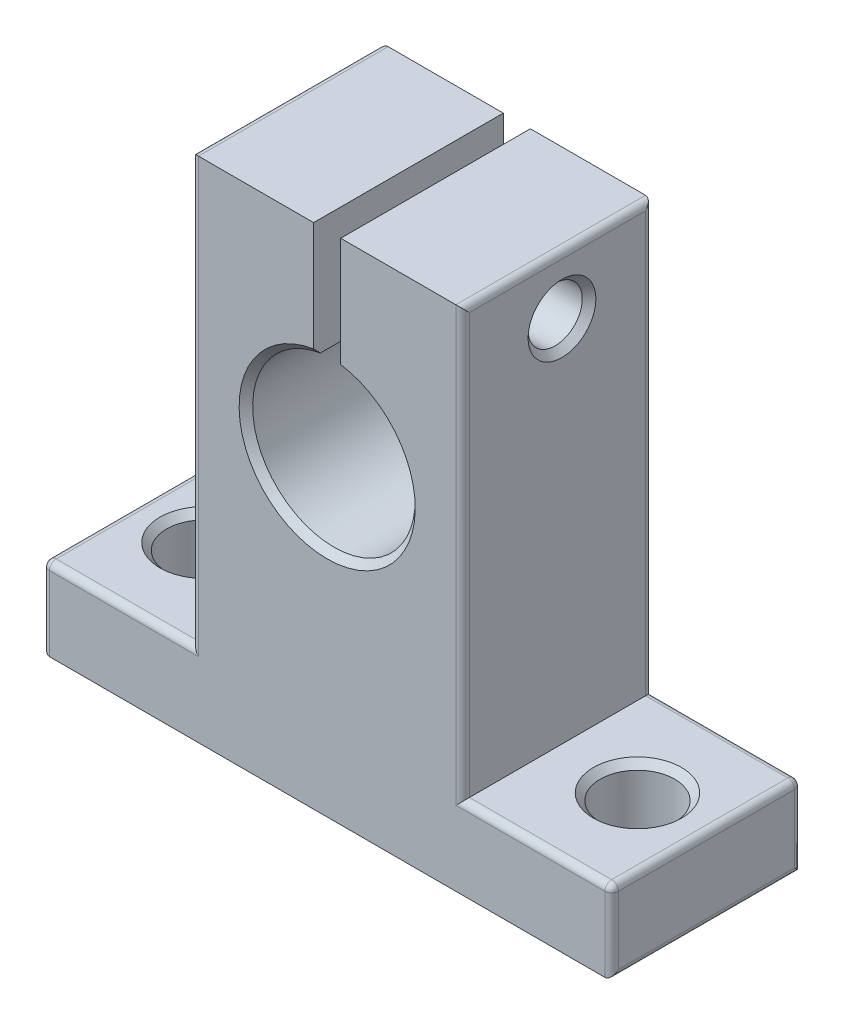
from build123d import *

# Parameters (mm, degrees)
BOSS_EXTRUDE1_DEPTH     = 7
SKETCH2_R               = 2.75
CUT_EXTRUDE1_DEPTH      = 39.5
CUT_EXTRUDE2_DEPTH      = 42.512046444
CUT_EXTRUDE2_DEPTH_BACK = 42.512046444
SKETCH5_R               = 2
CHAMFER2_SIZE           = 0.5
FILLET2_R               = 0.5


with BuildPart() as part:
    # Sketch1 → Boss-Extrude1 (new, symmetric)
    with BuildSketch(Plane.XY):
        with BuildLine():
            Line((-21, -3), (-21, 3))
            Line((-21, 3), (-10, 3))
            Line((-10, 3), (-10, 34.5))
            Line((-10, 34.5), (-1, 34.5))
            Line((-1, 34.5), (-1, 25.916079783))
            ThreePointArc((-1, 25.916079783), (0, 14), (1, 25.916079783))
            Line((1, 25.916079783), (1, 34.5))
            Line((1, 34.5), (10, 34.5))
            Line((10, 34.5), (10, 3))
            Line((10, 3), (21, 3))
            Line((21, 3), (21, -3))
            Line((21, -3), (-21, -3))
        make_face()
    extrude(amount=BOSS_EXTRUDE1_DEPTH, both=True)

    # Sketch2 → Cut-Extrude1 (cut, through all)
    with BuildSketch(Plane(origin=(0, 3, 0), x_dir=(1, 0, 0), z_dir=(0, 1, 0))):
        with Locations(Location((15.904501915, 0, 0), (0, 0, 180))):
            Circle(SKETCH2_R)
        with Locations(Location((-16.095498085, 0, 0), (0, 0, 180))):
            Circle(SKETCH2_R)
    extrude(amount=-CUT_EXTRUDE1_DEPTH, mode=Mode.SUBTRACT)

    # Sketch5 → Cut-Extrude2 (cut, two sides: drawn at the far end of the back side and taken through both)
    with BuildSketch(Plane(origin=(-1, 0, 0), x_dir=(0, 0, -1), z_dir=(1, 0, 0)).offset(-CUT_EXTRUDE2_DEPTH_BACK)):
        with Locations((0.330734984, 30.208039892)):
            Circle(SKETCH5_R)
    extrude(amount=CUT_EXTRUDE2_DEPTH + CUT_EXTRUDE2_DEPTH_BACK, mode=Mode.SUBTRACT)

    # Chamfer2
    chamfer2_edges = [part.edges().sort_by_distance(p)[0] for p in [
        (0, 14, -7),
        (0, 14, 7),
        (18.654501915, 3, 0),
        (-13.345498085, 3, 0),
        (-10, 30.208039892, 1.669265016),
        (10, 30.208039892, 1.669265016),
    ]]
    chamfer(chamfer2_edges, length=CHAMFER2_SIZE)

    # Fillet2
    fillet2_edges = [part.edges().sort_by_distance(p)[0] for p in [
        (-15.5, 3, 7),
        (10, 18.75, -7),
        (15.5, 3, -7),
        (-21, 0, 7),
        (21, 0, -7),
        (-21, 0, -7),
        (-15.5, 3, -7),
        (-10, 18.75, -7),
        (21, 0, 7),
        (10, 34.5, 0),
        (21, 3, 0),
        (21, -3, 0),
        (-21, -3, 0),
        (-21, 3, 0),
        (-10, 34.5, 0),
        (15.5, 3, 7),
        (10, 18.75, 7),
        (-10, 18.75, 7),
    ]]
    fillet(fillet2_edges, radius=FILLET2_R)


solid = part.part
